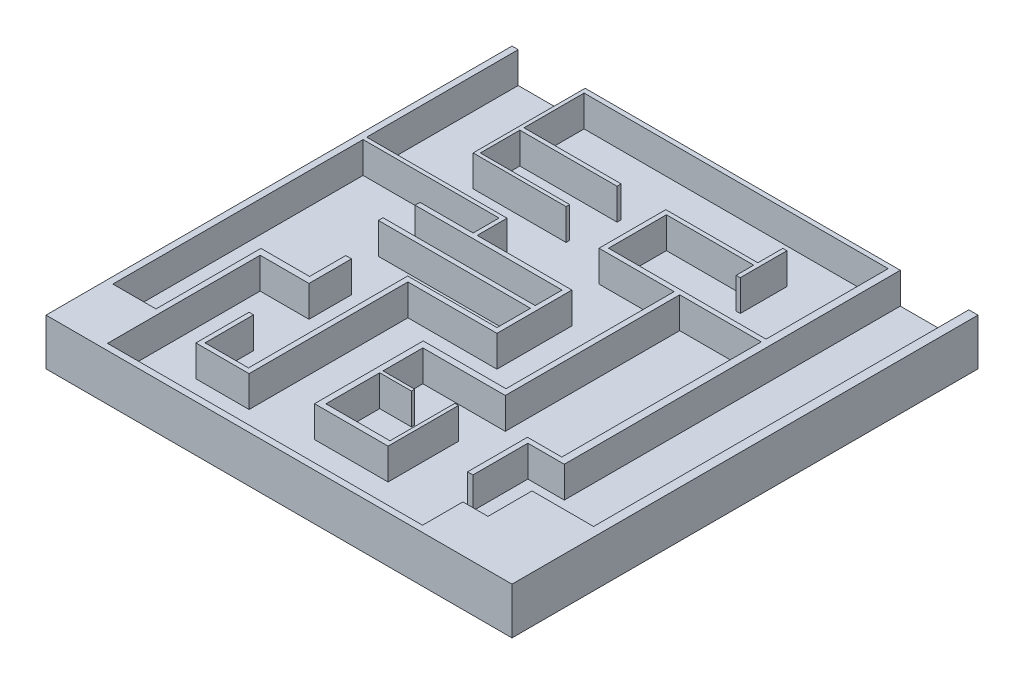
from build123d import *

# Parameters (mm, degrees)
SKETCH1_W           = 300
SKETCH1_H           = 300
BOSS_EXTRUDE1_DEPTH = 10
BOSS_EXTRUDE4_DEPTH = 20


with BuildPart() as part:
    # Sketch1 → Boss-Extrude1 (new body)
    with BuildSketch(Plane(origin=(0, 0, 0), x_dir=(1, 0, 0), z_dir=(0, 1, 0))):
        Rectangle(SKETCH1_W, SKETCH1_H)
    extrude(amount=BOSS_EXTRUDE1_DEPTH)

    # Sketch2 → Boss-Extrude4 (add)
    with BuildSketch(Plane(origin=(0, 10, 0), x_dir=(1, 0, 0), z_dir=(0, 1, 0))):
        Polygon((49.971374343, 108.306734699), (-9.273843692, 108.306734699), (-9.273843692, 65.302548914), (39.109683003, 65.302548914), (39.109683003, -42.978794556), (-14.169964592, -42.978794556), (-14.169964592, -112.952152785), (33.151642128, -112.952152785), (33.151642128, -67.566816692), (30.802124143, -67.566816692), (30.802124143, -109.346745837), (-10.423438765, -109.346745837), (-10.423438765, -74.73050528), (9.957336402, -74.73050528), (9.957336402, -72.613697765), (-10.423438765, -72.613697765), (-10.423438765, -46.978265259), (42.650315476, -46.978265259), (42.650315476, 65.302548914), (95.184908211, 65.302548914), (95.184908211, -63.123542137), (73.07070507, -63.123542137), (73.07070507, -101.668120527), (76.534473407, -101.668120527), (76.534473407, -66.320866756), (99.982757345, -66.320866756), (99.982757345, 150), (-102.935144351, 150), (-102.935144351, 77.901270739), (-43.092149345, 77.901270739), (-43.092149345, 80.20776174), (-100.595048935, 80.20776174), (-100.595048935, 105.650837757), (-37.989692586, 105.650837757), (-37.989692586, 108.306734699), (-100.595048935, 108.306734699), (-100.595048935, 147.003199663), (95.184908211, 147.003199663), (95.184908211, 68.375256183), (-6.232251129, 68.375256183), (-6.232251129, 105.650837757), (49.971374343, 105.650837757), (49.971374343, 94.342521139), (52.60088631, 94.342521139), (52.60088631, 124.362722745), (49.971374343, 124.362722745), align=None)
        Polygon((-146.001890411, 52.431305921), (-146.001890411, 150), (-150, 150), (-150, -150), (150, -150), (150, 150), (144.101294188, 150), (144.101294188, -91.584402299), (104.478721877, -91.584402299), (104.478721877, -119.965629386), (88.345614046, -119.965629386), (88.345614046, -145.94528604), (-114.452609493, -145.94528604), (-114.452609493, -47.69748233), (-83.008411836, -47.69748233), (-83.008411836, -20.290963527), (-86.710364357, -20.290963527), (-86.710364357, -43.614528655), (-118.021528945, -43.614528655), (-118.021528945, -111.174686517), (-145.802253378, -111.174686517), (-145.802253378, 49.940489366), (-58.285164429, 49.940489366), (-58.285164429, 33.250662457), (-92.45985442, 33.250662457), (-92.45985442, 30.093436444), (2.163221537, 30.093436444), (2.163221537, 12.78236321), (-95.832026153, 12.78236321), (-95.832026153, 9.764730819), (2.163221537, 9.764730819), (2.163221537, -11.779862869), (-55.377515494, -11.779862869), (-55.377515494, -114.277161571), (-83.335773751, -114.277161571), (-83.335773751, -83.046520825), (-86.246233134, -83.046520825), (-86.246233134, -117.269753185), (-51.991052188, -117.269753185), (-51.991052188, -15.009651935), (5.313331338, -15.009651935), (5.313331338, 33.250662457), (-55.651758488, 33.250662457), (-55.651758488, 52.431305921), align=None)
    extrude(amount=BOSS_EXTRUDE4_DEPTH)


solid = part.part
